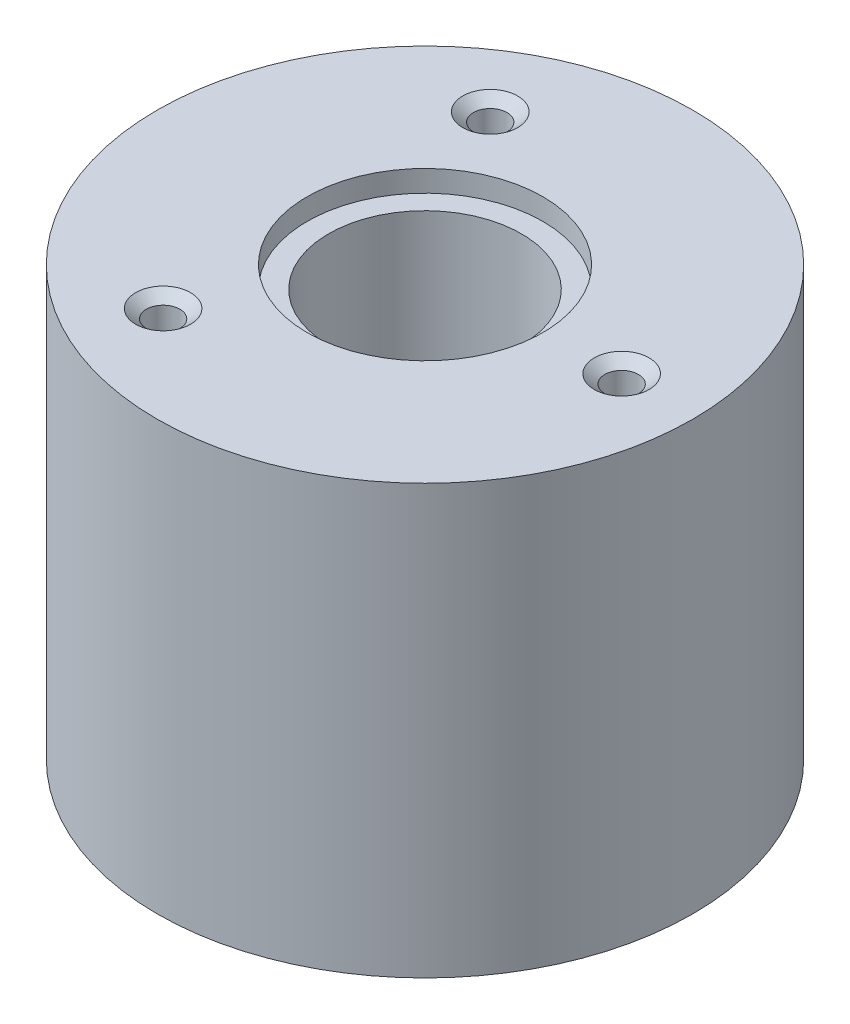
from build123d import *

# Parameters (mm, degrees)
SKETCH1_R           = 15.875
BOSS_EXTRUDE1_DEPTH = 25.4
SKETCH2_R           = 5.715
CUT_EXTRUDE1_DEPTH  = 34.89972345
SKETCH3_R           = 6.985
CUT_EXTRUDE2_DEPTH  = 1.27
CIRPATTERN3_COUNT   = 2
CIRPATTERN4_COUNT   = 3
CIRPATTERN5_COUNT   = 2


with BuildPart() as part:
    # Sketch1 → Boss-Extrude1 (new body)
    with BuildSketch(Plane(origin=(0, 0, 0), x_dir=(1, 0, 0), z_dir=(0, 1, 0))):
        with Locations(Location((0, 0, 0), (0, 0, 90))):
            Circle(SKETCH1_R)
    extrude(amount=BOSS_EXTRUDE1_DEPTH)

    # Sketch2 → Cut-Extrude1 (cut, through all)
    with BuildSketch(Plane(origin=(0, 25.4, 0), x_dir=(1, 0, 0), z_dir=(0, 1, 0))):
        with Locations(Location((0, 0, 0), (0, 0, 270))):
            Circle(SKETCH2_R)
    extrude(amount=-CUT_EXTRUDE1_DEPTH, mode=Mode.SUBTRACT)

    # Sketch3 → Cut-Extrude2 (cut)
    with BuildSketch(Plane(origin=(0, 25.4, 0), x_dir=(1, 0, 0), z_dir=(0, 1, 0))):
        with Locations(Location((0, 0, 0), (0, 0, 270))):
            Circle(SKETCH3_R)
    extrude(amount=-CUT_EXTRUDE2_DEPTH, mode=Mode.SUBTRACT)

    # Sketch10 → 1/4 (0.25) Diameter Hole2 (revolve, cut)
    with BuildSketch(Plane(origin=(8.917384444, 0, 6.43673099), x_dir=(0, 0, -1), z_dir=(1, 0, 0))):
        Polygon((0, 0), (0, 20.957732465), (3.175, 19.05), (3.175, 0), align=None)
    f_1_4_0_25_diameter_hole2 = revolve(axis=Axis((8.917384444, -6.35, 6.43673099), (0, 1, 0)), mode=Mode.SUBTRACT)

    # CirPattern3: 1/4 (0.25) Diameter Hole2 ×2 about axis
    cirpattern3_axis = Axis((0, 0, 0), (0, 1, 0))
    for i in range(1, CIRPATTERN3_COUNT):
        add(f_1_4_0_25_diameter_hole2.rotate(cirpattern3_axis, i * 360 / CIRPATTERN3_COUNT), mode=Mode.SUBTRACT)

    # Sketch13 → 5/64 (0.07813) Diameter Hole1 (revolve, cut)
    with BuildSketch(Plane(origin=(-5.914180419, 25.4, -9.780969787), x_dir=(0, 0, 1), z_dir=(1, 0, 0))):
        Polygon((0, 0), (0, 10.75620455), (0.992251, 10.16), (0.992251, 0.532828266), (1.627251, 0), align=None)
    f_5_64_0_07813_diameter_hole1 = revolve(axis=Axis((-5.914180419, 31.75, -9.780969787), (0, -1, 0)), mode=Mode.SUBTRACT)

    # CirPattern4: 5/64 (0.07813) Diameter Hole1 ×3 about axis
    cirpattern4_axis = Axis((0, 0, 0), (0, 1, 0))
    for i in range(1, CIRPATTERN4_COUNT):
        add(f_5_64_0_07813_diameter_hole1.rotate(cirpattern4_axis, i * 360 / CIRPATTERN4_COUNT), mode=Mode.SUBTRACT)

    # Sketch16 → 1/16 (0.0625) Diameter Hole1 (revolve, cut)
    with BuildSketch(Plane(origin=(-3.214022597, 0, -10.637561516), x_dir=(0, 0, -1), z_dir=(1, 0, 0))):
        Polygon((0, 0), (0, 13.176933116), (0.79375, 12.7), (0.79375, 0.532828266), (1.42875, 0), align=None)
    f_1_16_0_0625_diameter_hole1 = revolve(axis=Axis((-3.214022597, -6.35, -10.637561516), (0, 1, 0)), mode=Mode.SUBTRACT)

    # CirPattern5: 1/16 (0.0625) Diameter Hole1 ×2 about axis
    cirpattern5_axis = Axis((0, 0, 0), (0, 1, 0))
    for i in range(1, CIRPATTERN5_COUNT):
        add(f_1_16_0_0625_diameter_hole1.rotate(cirpattern5_axis, i * 360 / CIRPATTERN5_COUNT), mode=Mode.SUBTRACT)


solid = part.part
